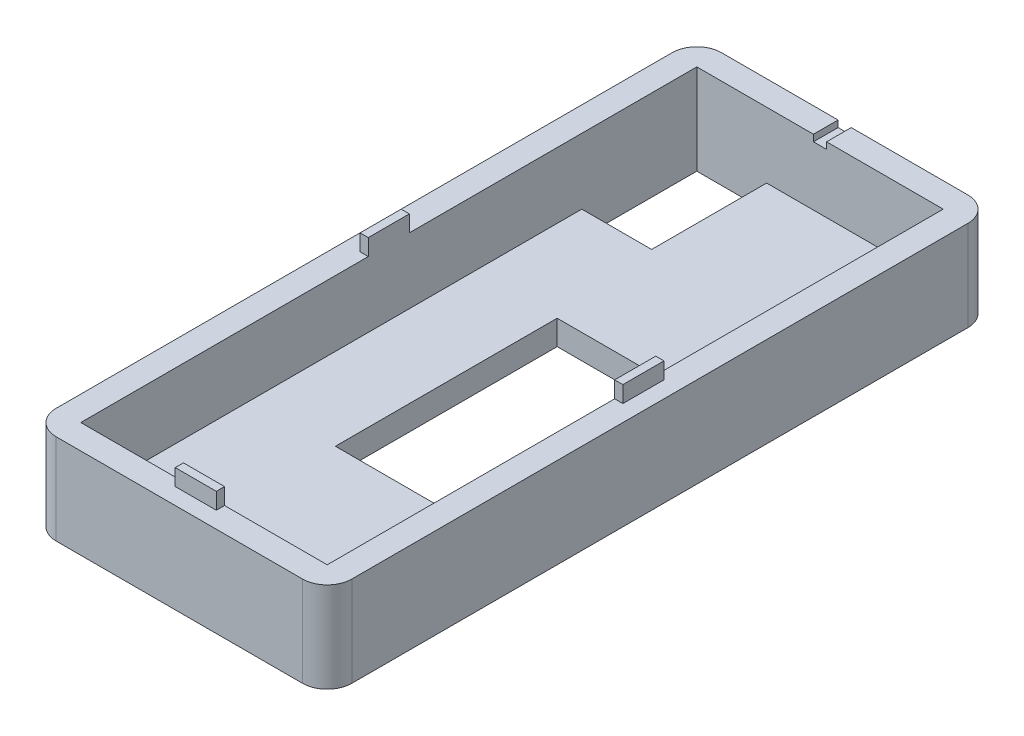
from build123d import *

# Parameters (mm, degrees)
SKETCH1_W           = 36
SKETCH1_H           = 81
BOSS_EXTRUDE1_DEPTH = 11
SKETCH2_W           = 30
SKETCH2_H           = 75
CUT_EXTRUDE1_DEPTH  = 8
FILLET1_R           = 3
SKETCH3_W           = 1.6
SKETCH3_H           = 3
CUT_EXTRUDE2_DEPTH  = 0.8
SKETCH4_W           = 1
SKETCH4_H           = 5
SKETCH4_W_2         = 5
SKETCH4_H_2         = 1
BOSS_EXTRUDE2_DEPTH = 2
SKETCH5_W           = 8.5
SKETCH5_H           = 14
SKETCH5_W_2         = 15
SKETCH5_H_2         = 27
CUT_EXTRUDE4_DEPTH  = 8


with BuildPart() as part:
    # Sketch1 → Boss-Extrude1 (new body)
    with BuildSketch(Plane(origin=(0, 0, 0), x_dir=(1, 0, 0), z_dir=(0, 1, 0))):
        with Locations((18, 40.5)):
            Rectangle(SKETCH1_W, SKETCH1_H)
    extrude(amount=BOSS_EXTRUDE1_DEPTH)

    # Sketch2 → Cut-Extrude1 (cut)
    with BuildSketch(Plane(origin=(0, 11, 0), x_dir=(1, 0, 0), z_dir=(0, 1, 0))):
        with Locations((18, 40.5)):
            Rectangle(SKETCH2_W, SKETCH2_H)
    extrude(amount=-CUT_EXTRUDE1_DEPTH, mode=Mode.SUBTRACT)

    # Fillet1
    fillet1_edges = [part.edges().sort_by_distance(p)[0] for p in [
        (0, 5.5, -81),
        (36, 5.5, -81),
        (36, 5.5, 0),
        (0, 5.5, 0),
    ]]
    fillet(fillet1_edges, radius=FILLET1_R)

    # Sketch3 → Cut-Extrude2 (cut)
    with BuildSketch(Plane(origin=(0, 11, 0), x_dir=(1, 0, 0), z_dir=(0, 1, 0))):
        with Locations((18, 79.5)):
            Rectangle(SKETCH3_W, SKETCH3_H)
    extrude(amount=-CUT_EXTRUDE2_DEPTH, mode=Mode.SUBTRACT)

    # Sketch4 → Boss-Extrude2 (add)
    with BuildSketch(Plane(origin=(0, 11, 0), x_dir=(1, 0, 0), z_dir=(0, 1, 0))):
        with Locations((2.5, 40.5)):
            Rectangle(SKETCH4_W, SKETCH4_H)
        with Locations((33.5, 40.5)):
            Rectangle(SKETCH4_W, SKETCH4_H)
        with Locations((18, 2.5)):
            Rectangle(SKETCH4_W_2, SKETCH4_H_2)
    extrude(amount=BOSS_EXTRUDE2_DEPTH)

    # Sketch5 → Cut-Extrude4 (cut)
    with BuildSketch(Plane.XZ):
        with Locations((7.25, -71)):
            Rectangle(SKETCH5_W, SKETCH5_H)
        with Locations((20.5, -37.5)):
            Rectangle(SKETCH5_W_2, SKETCH5_H_2)
    extrude(amount=-CUT_EXTRUDE4_DEPTH, mode=Mode.SUBTRACT)


solid = part.part
